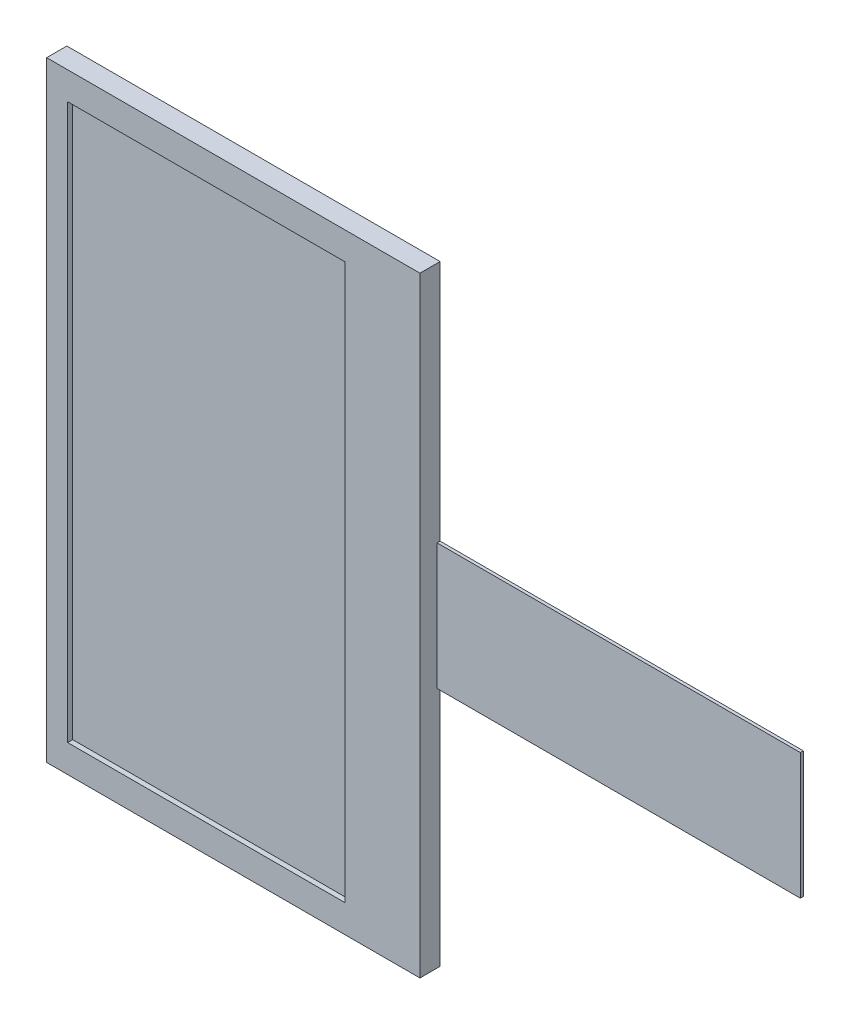
from build123d import *

# Parameters (mm, degrees)
SKETCH1_W           = 27.49
SKETCH1_H           = 55.01
BOSS_EXTRUDE1_DEPTH = 1.5
SKETCH1_3_W         = 27.49
SKETCH1_3_H         = 55.01
BOSS_EXTRUDE2_DEPTH = 2
SKETCH1_4_W         = 36
SKETCH1_4_H         = 12.5
BOSS_EXTRUDE3_DEPTH = 0.3


with BuildPart() as part:
    # Sketch1 → Boss-Extrude1 (new body)
    with BuildSketch(Plane.XY):
        Rectangle(SKETCH1_W, SKETCH1_H)
    extrude(amount=BOSS_EXTRUDE1_DEPTH)


with BuildPart() as body_2:
    # Sketch1<3> → Boss-Extrude2 (new body)
    with BuildSketch(Plane.XY):
        Polygon((21.175, 6.245), (21.175, 30.245), (-15.825, 30.245), (-15.825, -30.255), (21.175, -30.255), (21.175, -6.255), align=None)
        Rectangle(SKETCH1_3_W, SKETCH1_3_H, mode=Mode.SUBTRACT)
    extrude(amount=BOSS_EXTRUDE2_DEPTH)


with BuildPart() as body_3:
    # Sketch1<4> → Boss-Extrude3 (new body)
    with BuildSketch(Plane.XY):
        with Locations((39.175, -0.005)):
            Rectangle(SKETCH1_4_W, SKETCH1_4_H)
    extrude(amount=BOSS_EXTRUDE3_DEPTH)


solid = Compound([part.part, body_2.part, body_3.part])
